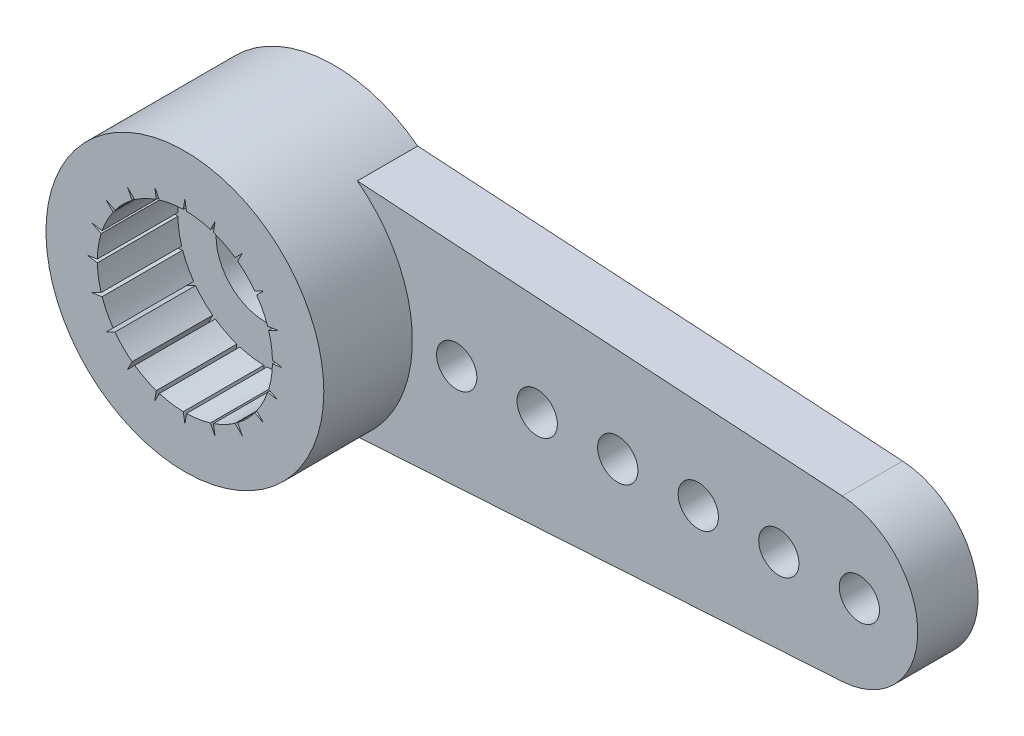
from build123d import *
from build123d.topology import SkipClean

# Parameters (mm, degrees)
EXTRUDE_1_DEPTH          = 1.5
SKETCH_2_R               = 3.45
EXTRUDE_2_DEPTH          = 2.2
SKETCH_4_R               = 1.225
CUT_EXTRUDE_2_DEPTH      = 17.780718101
SKETCH_3_R               = 2.175
CUT_EXTRUDE_1_DEPTH      = 2
CUT_EXTRUDE_3_DEPTH      = 2
PATTERN_CIRCULAR_1_COUNT = 20
SKETCH_6_R               = 2.35
CUT_EXTRUDE_4_DEPTH      = 1
SKETCH_7_R               = 0.5
CUT_EXTRUDE_5_DEPTH      = 17.514917499
CUT_EXTRUDE_6_DEPTH      = 17.780718101


with BuildPart() as part:
    # 草图1 → 凸台-拉伸1 (new body)
    with BuildSketch(Plane.XY):
        with BuildLine():
            Line((-14.124971514, 1.996091711), (-2.083266666, 2.75))
            ThreePointArc((-2.083266666, 2.75), (0, 3.45), (2.083266666, 2.75))
            Line((2.083266666, 2.75), (14.124971514, 1.996091711))
            ThreePointArc((14.124971514, 1.996091711), (16, 0), (14.124971514, -1.996091711))
            Line((14.124971514, -1.996091711), (2.083266666, -2.75))
            ThreePointArc((2.083266666, -2.75), (0, -3.45), (-2.083266666, -2.75))
            Line((-2.083266666, -2.75), (-14.124971514, -1.996091711))
            ThreePointArc((-14.124971514, -1.996091711), (-16, 0), (-14.124971514, 1.996091711))
        make_face()
    extrude(amount=EXTRUDE_1_DEPTH)

    # 草图2 → 凸台-拉伸2 (add)
    with SkipClean():  # the faces are left unmerged after this step: merging them gives an invalid solid
        with BuildSketch(Plane.XY.offset(1.5)):
            with Locations(Location((0, 0, 0), (0, 0, 127.145804172))):
                Circle(SKETCH_2_R)
        extrude(amount=EXTRUDE_2_DEPTH)

    # 草图4 → 切除-拉伸2 (cut, through all)
    with SkipClean():  # the faces are left unmerged after this step: merging them gives an invalid solid
        with BuildSketch(Plane(origin=(0, 0, 0), x_dir=(-1, 0, 0), z_dir=(0, 0, -1))):
            Circle(SKETCH_4_R)
        extrude(amount=-CUT_EXTRUDE_2_DEPTH, mode=Mode.SUBTRACT)

    # 草图3 → 切除-拉伸1 (cut)
    with SkipClean():  # the faces are left unmerged after this step: merging them gives an invalid solid
        with BuildSketch(Plane.XY.offset(3.7)):
            Circle(SKETCH_3_R)
        extrude(amount=-CUT_EXTRUDE_1_DEPTH, mode=Mode.SUBTRACT)

    # 草图5 → 切除-拉伸3 (cut)
    with SkipClean():  # the faces are left unmerged after this step: merging them gives an invalid solid
        with BuildSketch(Plane.XY.offset(3.7)):
            Polygon((2.425, 0), (1.700332145, 0.114776113), (1.700332145, -0.114776113), align=None)
        cut_extrude_3 = extrude(amount=-CUT_EXTRUDE_3_DEPTH, mode=Mode.SUBTRACT)

    # 阵列(圆周)1: 切除-拉伸3 ×20 about axis
    with SkipClean():  # the faces are left unmerged after this step: merging them gives an invalid solid
        pattern_circular_1_axis = Axis((0, 0, 0), (0, 0, 1))
        for i in range(1, PATTERN_CIRCULAR_1_COUNT):
            add(cut_extrude_3.rotate(pattern_circular_1_axis, i * 360 / PATTERN_CIRCULAR_1_COUNT), mode=Mode.SUBTRACT)

    # 草图6 → 切除-拉伸4 (cut)
    with SkipClean():  # the faces are left unmerged after this step: merging them gives an invalid solid
        with BuildSketch(Plane(origin=(0, 0, 0), x_dir=(-1, 0, 0), z_dir=(0, 0, -1))):
            Circle(SKETCH_6_R)
        extrude(amount=-CUT_EXTRUDE_4_DEPTH, mode=Mode.SUBTRACT)

    # 草图7 → 切除-拉伸5 (cut, through all)
    with SkipClean():  # the faces are left unmerged after this step: merging them gives an invalid solid
        with BuildSketch(Plane.XY.offset(1.5)):
            with Locations((-4.55, 0)):
                Circle(SKETCH_7_R)
            with Locations((-6.55, 0)):
                Circle(SKETCH_7_R)
            with Locations((-8.55, 0)):
                Circle(SKETCH_7_R)
            with Locations((-10.55, 0)):
                Circle(SKETCH_7_R)
            with Locations((-12.55, 0)):
                Circle(SKETCH_7_R)
            with Locations((-14.55, 0)):
                Circle(SKETCH_7_R)
        cut_extrude_5 = extrude(amount=-CUT_EXTRUDE_5_DEPTH, mode=Mode.SUBTRACT)

    # 镜向1: 切除-拉伸5 across plane
    with SkipClean():  # the faces are left unmerged after this step: merging them gives an invalid solid
        add(cut_extrude_5.mirror(Plane(origin=(0, 0, 0), x_dir=(0, 0, 1), z_dir=(1, 0, 0))), mode=Mode.SUBTRACT)

    # 草图8 → 切除-拉伸6 (cut, through all)
    with SkipClean():  # the faces are left unmerged after this step: merging them gives an invalid solid
        with BuildSketch(Plane.XY.offset(3.7)):
            with BuildLine():
                Line((-2.083266666, 2.75), (-16, 2.75))
                Line((-16, 2.75), (-16, -2.75))
                Line((-16, -2.75), (-2.083266666, -2.75))
                ThreePointArc((-2.083266666, -2.75), (-3.45, 0), (-2.083266666, 2.75))
            make_face()
        extrude(amount=-CUT_EXTRUDE_6_DEPTH, mode=Mode.SUBTRACT)


solid = part.part
